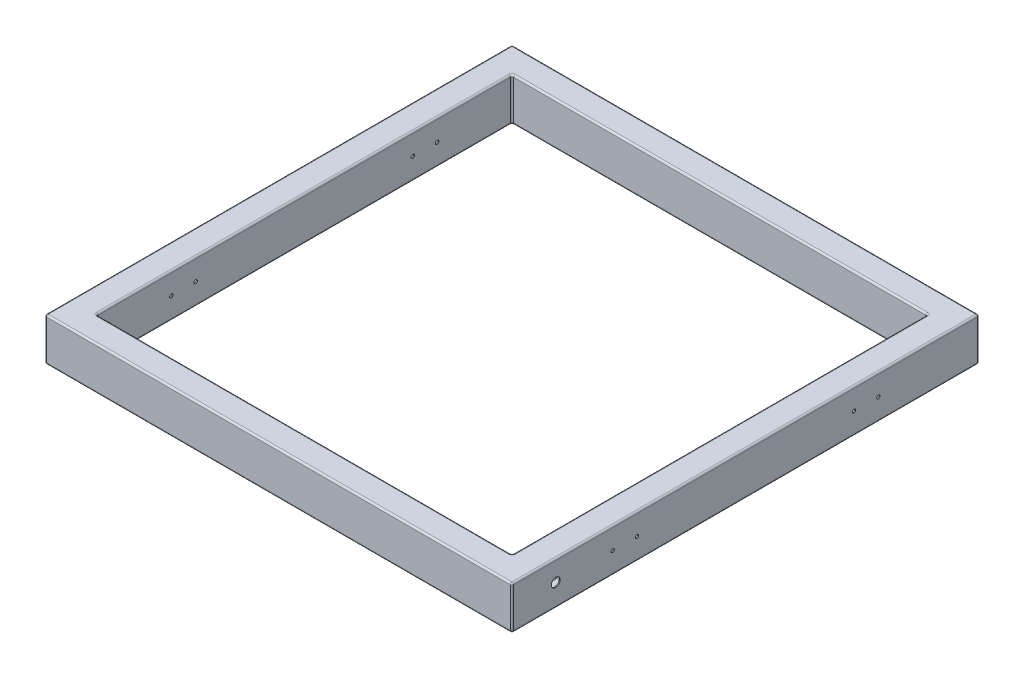
from build123d import *

# Parameters (mm, degrees)
SKETCH1_W           = 1360
SKETCH1_H           = 1360
SKETCH1_W_2         = 1210
SKETCH1_H_2         = 1210
BOSS_EXTRUDE1_DEPTH = 125
FILLET1_R           = 5
SHELL1_T            = 3
SKETCH2_R           = 5
CUT_EXTRUDE1_DEPTH  = 1526.655596785
CUT_EXTRUDE2_REACH  = 1527.656
SKETCH3_R           = 13


with BuildPart() as part:
    # Sketch1 → Boss-Extrude1 (new body)
    with BuildSketch(Plane(origin=(0, 0, 0), x_dir=(1, 0, 0), z_dir=(0, 1, 0))):
        Rectangle(SKETCH1_W, SKETCH1_H)
        Rectangle(SKETCH1_W_2, SKETCH1_H_2, mode=Mode.SUBTRACT)
    extrude(amount=BOSS_EXTRUDE1_DEPTH)

    # Fillet1
    fillet1_edges = [part.edges().sort_by_distance(p)[0] for p in [
        (-680, 125, 0),
        (0, 125, 680),
        (605, 0, 0),
        (605, 62.5, 605),
        (0, 0, -605),
        (605, 62.5, -605),
        (-605, 0, 0),
        (-605, 62.5, -605),
        (0, 0, 605),
        (-605, 62.5, 605),
        (605, 125, 0),
        (0, 125, -605),
        (-605, 125, 0),
        (0, 125, 605),
        (680, 125, 0),
        (0, 0, 680),
        (-680, 0, 0),
        (0, 0, -680),
        (680, 0, 0),
        (0, 125, -680),
        (680, 62.5, 680),
        (-680, 62.5, 680),
        (-680, 62.5, -680),
        (680, 62.5, -680),
    ]]
    fillet(fillet1_edges, radius=FILLET1_R)

    # Shell1 (no face opened: a closed hollow body)
    add(offset(amount=-SHELL1_T, mode=Mode.PRIVATE), mode=Mode.SUBTRACT)

    # Sketch2 → Cut-Extrude1 (cut, through all)
    with BuildSketch(Plane.ZY.offset(680)):
        with Locations(Location((-387, 62.5, 0), (0, 0, 180))):
            Circle(SKETCH2_R)
        with Locations(Location((-316, 62.5, 0), (0, 0, 180))):
            Circle(SKETCH2_R)
        with Locations(Location((387, 62.5, 0), (0, 0, 180))):
            Circle(SKETCH2_R)
        with Locations(Location((316, 62.5, 0), (0, 0, 180))):
            Circle(SKETCH2_R)
    extrude(amount=-CUT_EXTRUDE1_DEPTH, mode=Mode.SUBTRACT)

    # Cut-Extrude2: up to this face of the body (flat: up to its plane)
    cut_extrude2_end = Plane(part.part.faces().sort_by_distance((605, 62.5, 0))[0])
    # Sketch3 → Cut-Extrude2 (cut, up to the picked face)
    with BuildSketch(Plane(origin=(680, 0, 0), x_dir=(0, 0, -1), z_dir=(1, 0, 0)), mode=Mode.PRIVATE) as cut_extrude2_sk1:
        with Locations(Location((-552.5, 65, 0), (0, 0, 180))):
            Circle(SKETCH3_R)
    cut_extrude2_tool1 = split(extrude(cut_extrude2_sk1.sketch, amount=-CUT_EXTRUDE2_REACH, mode=Mode.PRIVATE), bisect_by=cut_extrude2_end, keep=Keep.BOTH, mode=Mode.PRIVATE)
    add(cut_extrude2_tool1.solids().sort_by(Axis((680, 65, 552.5), (-1, 0, 0)))[0], mode=Mode.SUBTRACT)


solid = part.part
